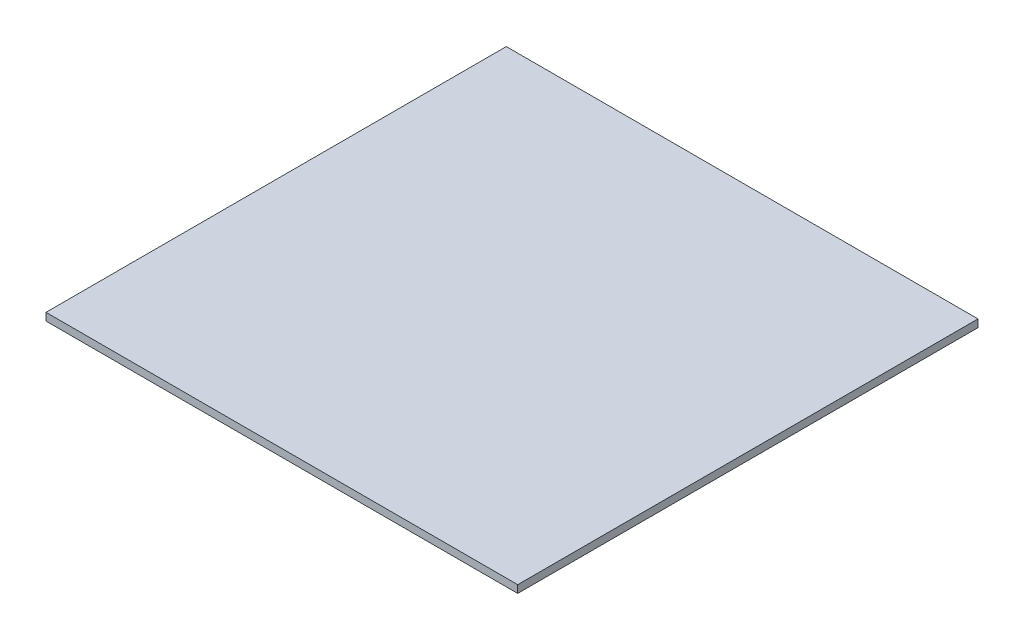
from build123d import *

# Parameters (mm, degrees)
SKETCH1_W           = 496
SKETCH1_H           = 484
BOSS_EXTRUDE1_DEPTH = 8


with BuildPart() as part:
    # Sketch1 → Boss-Extrude1 (new body)
    with BuildSketch(Plane(origin=(0, 0, 0), x_dir=(1, 0, 0), z_dir=(0, 1, 0))):
        Rectangle(SKETCH1_W, SKETCH1_H)
    extrude(amount=BOSS_EXTRUDE1_DEPTH)


solid = part.part
